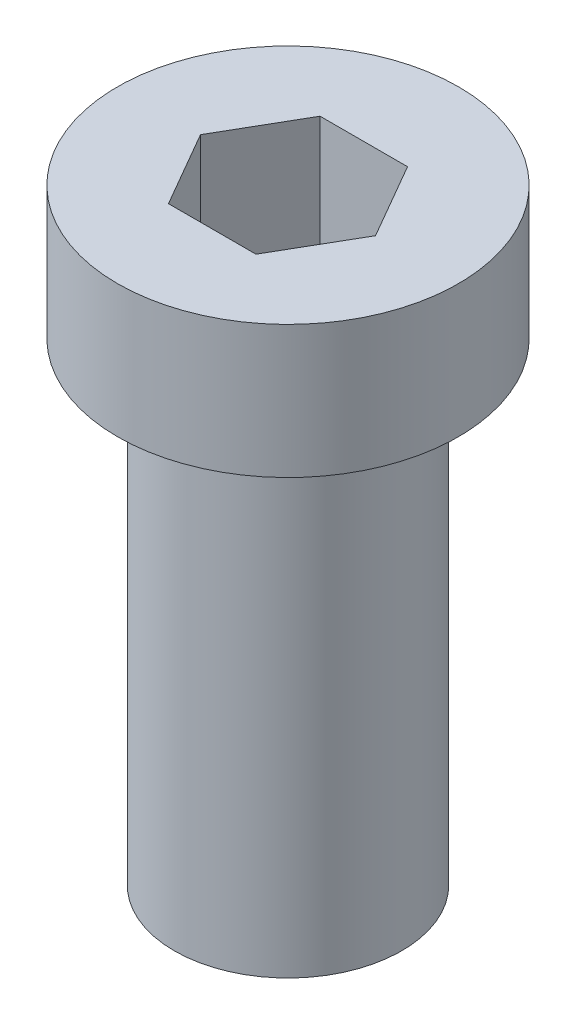
from build123d import *

# Parameters (mm, degrees)
CUT_EXTRUDE1_DEPTH = 6


with BuildPart() as part:
    # Sketch1 → Revolve1 (revolve)
    with BuildSketch(Plane.XY, mode=Mode.PRIVATE) as revolve1_sk:
        Polygon((0, -25), (6, -25), (6, 0), (9, 0), (9, 7), (0, 7), align=None)
    revolve(revolve1_sk.sketch.rotate(Axis((0, 61.691642626, 0), (0, -1, 0)), 90), axis=Axis((0, 61.691642626, 0), (0, -1, 0)))

    # Sketch2 → Cut-Extrude1 (cut)
    with BuildSketch(Plane(origin=(0, 7, 0), x_dir=(-1, 0, 0), z_dir=(0, 1, 0))):
        Polygon((-2.309401077, -4), (2.309401077, -4), (4.618802154, 0), (2.309401077, 4), (-2.309401077, 4), (-4.618802154, 0), align=None)
    extrude(amount=-CUT_EXTRUDE1_DEPTH, mode=Mode.SUBTRACT)


solid = part.part
